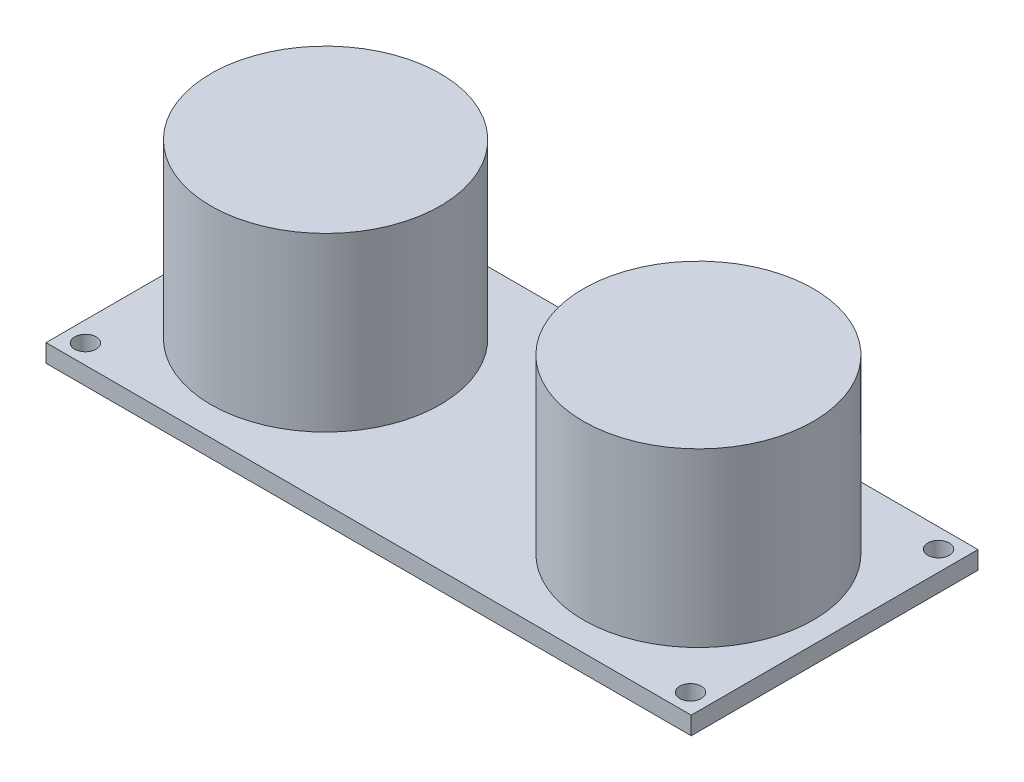
from build123d import *

# Parameters (mm, degrees)
SKETCH1_W           = 45
SKETCH1_H           = 20
SKETCH1_R           = 0.75
BOSS_EXTRUDE1_DEPTH = 1.25
SKETCH3_R           = 8
BOSS_EXTRUDE2_DEPTH = 12
SKETCH4_R           = 8.018104591
BOSS_EXTRUDE3_DEPTH = 12


with BuildPart() as part:
    # Sketch1 → Boss-Extrude1 (new body)
    with BuildSketch(Plane(origin=(0, 0, 0), x_dir=(1, 0, 0), z_dir=(0, 1, 0))):
        with Locations((22.5, -10)):
            Rectangle(SKETCH1_W, SKETCH1_H)
        with Locations(Location((1.4, -18.65, 0), (0, 0, 270))):
            Circle(SKETCH1_R, mode=Mode.SUBTRACT)
        with Locations(Location((1.4, -1.35, 0), (0, 0, 90))):
            Circle(SKETCH1_R, mode=Mode.SUBTRACT)
        with Locations(Location((43.6, -18.65, 0), (0, 0, 90))):
            Circle(SKETCH1_R, mode=Mode.SUBTRACT)
        with Locations(Location((43.6, -1.35, 0), (0, 0, 270))):
            Circle(SKETCH1_R, mode=Mode.SUBTRACT)
    extrude(amount=BOSS_EXTRUDE1_DEPTH)

    # Sketch3 → Boss-Extrude2 (add)
    with BuildSketch(Plane(origin=(0, 1.25, 0), x_dir=(1, 0, 0), z_dir=(0, 1, 0))):
        with Locations(Location((9.5, -10, 0), (0, 0, 270))):
            Circle(SKETCH3_R)
    extrude(amount=BOSS_EXTRUDE2_DEPTH)

    # Sketch4 → Boss-Extrude3 (add)
    with BuildSketch(Plane(origin=(0, 1.25, 0), x_dir=(1, 0, 0), z_dir=(0, 1, 0))):
        with Locations(Location((35.5, -10, 0), (0, 0, 270))):
            Circle(SKETCH4_R)
    extrude(amount=BOSS_EXTRUDE3_DEPTH)


solid = part.part
